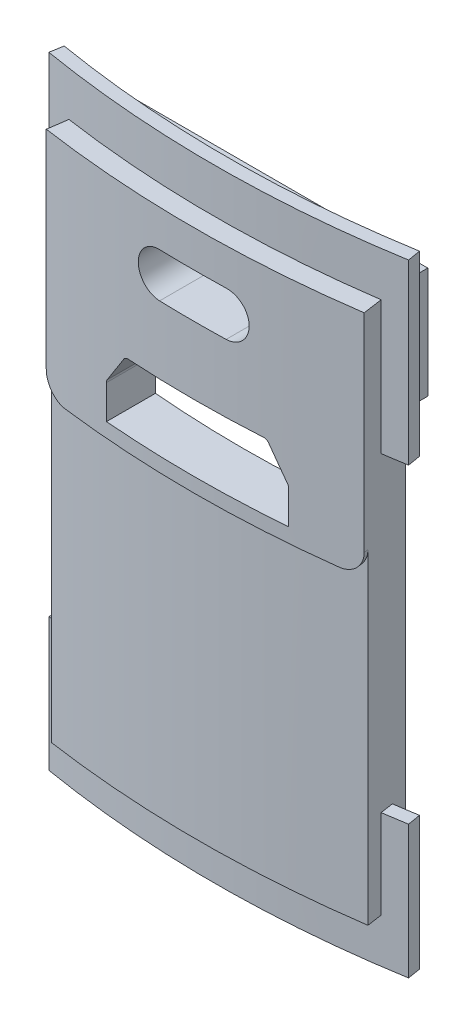
from build123d import *
from build123d.topology import SkipClean

# Parameters (mm, degrees)
EXTRUDE_1_DEPTH          = 24
CUT_EXTRUDE_2_DEPTH      = 5
CUT_EXTRUDE_2_DEPTH_BACK = 5
EXTRUDE_2_DEPTH          = 24
EXTRUDE_START            = 2
EXTRUDE_3_DEPTH          = 2
EXTRUDE_4_DEPTH          = 2
CUT_EXTRUDE_3_DEPTH      = 13.65
FILLET_1_R               = 1
CUT_EXTRUDE_START        = -8
CUT_EXTRUDE_5_DEPTH      = 14
EXTRUDE_START_2          = -5
EXTRUDE_5_DEPTH          = 5
CUT_EXTRUDE_START_2      = -1.49247673
CUT_EXTRUDE_6_DEPTH      = 1.49247673


with BuildPart() as part:
    # Эскиз1 → Бобышка-Вытянуть1 (new body)
    with BuildSketch(Plane(origin=(0, 0, 0), x_dir=(1, 0, 0), z_dir=(0, 1, 0))):
        with BuildLine():
            Line((-6.84384702, 0.49247673), (-7.158835795, -1.684856977))
            ThreePointArc((-7.158835795, -1.684856977), (0, -2.2), (7.158835795, -1.684856977))
            Line((7.158835795, -1.684856977), (6.84384702, 0.49247673))
            ThreePointArc((6.84384702, 0.49247673), (0, 0), (-6.84384702, 0.49247673))
        make_face()
    extrude(amount=EXTRUDE_1_DEPTH)

    # Эскиз2 → Вырез-Вытянуть2 (cut, two sides: drawn at the far end of the back side and taken through both)
    with BuildSketch(Plane.XY.offset(-CUT_EXTRUDE_2_DEPTH_BACK)):
        with BuildLine():
            Line((3.05, 17.3), (-3.05, 17.3))
            ThreePointArc((-3.05, 17.3), (-3.169210201, 17.269768771), (-3.259607324, 17.186381965))
            Line((-3.259607324, 17.186381965), (-4.059452109, 15.958486928))
            ThreePointArc((-4.059452109, 15.958486928), (-4.089648868, 15.893165149), (-4.1, 15.821949749))
            Line((-4.1, 15.821949749), (-4.1, 14.788048333))
            Line((-4.1, 14.788048333), (-4.1, 14.3))
            Line((-4.1, 14.3), (4.1, 14.3))
            Line((4.1, 14.3), (4.1, 14.788048333))
            Line((4.1, 14.788048333), (4.1, 15.821949749))
            ThreePointArc((4.1, 15.821949749), (4.089648868, 15.893165149), (4.059452109, 15.958486928))
            Line((4.059452109, 15.958486928), (3.259607324, 17.186381965))
            ThreePointArc((3.259607324, 17.186381965), (3.169210201, 17.269768771), (3.05, 17.3))
        make_face()
        with BuildLine():
            Line((-0.063165968, 22.35), (1.436834032, 22.35))
            ThreePointArc((1.436834032, 22.35), (2.436834032, 21.35), (1.436834032, 20.35))
            Line((1.436834032, 20.35), (-1.563165968, 20.35))
            ThreePointArc((-1.563165968, 20.35), (-2.563165968, 21.35), (-1.563165968, 22.35))
            Line((-1.563165968, 22.35), (-0.063165968, 22.35))
        make_face()
    extrude(amount=CUT_EXTRUDE_2_DEPTH + CUT_EXTRUDE_2_DEPTH_BACK, mode=Mode.SUBTRACT)

    # Эскиз3 → Бобышка-Вытянуть2 (add)
    with BuildSketch(Plane(origin=(0, 24, 0), x_dir=(1, 0, 0), z_dir=(0, 1, 0))):
        with BuildLine():
            Line((-8.001110971, -0.035470346), (-8.100093787, -0.627249361))
            ThreePointArc((-8.100093787, -0.627249361), (-7.565495415, -0.713640135), (-7.029976751, -0.794129552))
            Line((-7.029976751, -0.794129552), (-6.944070721, -0.200311268))
            ThreePointArc((-6.944070721, -0.200311268), (-7.473045369, -0.120805428), (-8.001110971, -0.035470346))
        make_face()
        with BuildLine():
            Line((8.001110971, -0.035470346), (8.100093787, -0.627249361))
            ThreePointArc((8.100093787, -0.627249361), (7.565495415, -0.713640135), (7.029976751, -0.794129552))
            Line((7.029976751, -0.794129552), (6.944070721, -0.200311268))
            ThreePointArc((6.944070721, -0.200311268), (7.473045369, -0.120805428), (8.001110971, -0.035470346))
        make_face()
    extrude(amount=-EXTRUDE_2_DEPTH)

    # Эскиз4 → Бобышка-Вытянуть3 (add)
    with SkipClean():  # the faces are left unmerged after this step: merging them gives an invalid solid
        with BuildSketch(Plane(origin=(0, 24, 0), x_dir=(1, 0, 0), z_dir=(0, 1, 0)).offset(EXTRUDE_START)):
            with BuildLine():
                Line((-8.001110971, -0.035470346), (-8.100093787, -0.627249361))
                ThreePointArc((-8.100093787, -0.627249361), (0, -1.3), (8.100093787, -0.627249361))
                Line((8.100093787, -0.627249361), (8.001110971, -0.035470346))
                ThreePointArc((8.001110971, -0.035470346), (0, -0.7), (-8.001110971, -0.035470346))
            make_face()
        extrude(amount=-EXTRUDE_3_DEPTH)

    # Эскиз5 → Бобышка-Вытянуть4 (add)
    with SkipClean():  # the faces are left unmerged after this step: merging them gives an invalid solid
        with BuildSketch(Plane.XZ):
            with BuildLine():
                Line((8.001110971, 0.035470346), (8.100093787, 0.627249361))
                ThreePointArc((8.100093787, 0.627249361), (0, 1.3), (-8.100093787, 0.627249361))
                Line((-8.100093787, 0.627249361), (-8.001110971, 0.035470346))
                ThreePointArc((-8.001110971, 0.035470346), (0, 0.7), (8.001110971, 0.035470346))
            make_face()
        extrude(amount=EXTRUDE_4_DEPTH)

    # Эскиз6 → Вырез-Вытянуть3 (cut)
    with SkipClean():  # the faces are left unmerged after this step: merging them gives an invalid solid
        with BuildSketch(Plane.XZ):
            with BuildLine():
                Line((-7.158835795, 1.684856977), (-7.130200452, 1.486917549))
                ThreePointArc((-7.130200452, 1.486917549), (0, 2), (7.130200452, 1.486917549))
                Line((7.130200452, 1.486917549), (7.158835795, 1.684856977))
                ThreePointArc((7.158835795, 1.684856977), (0, 2.2), (-7.158835795, 1.684856977))
            make_face()
        extrude(amount=-CUT_EXTRUDE_3_DEPTH, mode=Mode.SUBTRACT)

    # Скругление1
    fillet_1_edges = [part.edges().sort_by_distance(p)[0] for p in [
        (7.144518124, 13.65, 1.585887263),
        (-7.144518124, 13.65, 1.585887263),
    ]]
    fillet(fillet_1_edges, radius=FILLET_1_R)

    # Эскиз8 → Вырез-Вытянуть5 (cut)
    with SkipClean():  # the faces are left unmerged after this step: merging them gives an invalid solid
        with BuildSketch(Plane(origin=(0, 26, 0), x_dir=(1, 0, 0), z_dir=(0, 1, 0)).offset(CUT_EXTRUDE_START)):
            with BuildLine():
                Line((8.100093787, -0.627249361), (8.001110971, -0.035470346))
                ThreePointArc((8.001110971, -0.035470346), (7.473045369, -0.120805428), (6.944070721, -0.200311268))
                Line((6.944070721, -0.200311268), (7.029976751, -0.794129552))
                ThreePointArc((7.029976751, -0.794129552), (7.565495415, -0.713640135), (8.100093787, -0.627249361))
            make_face()
            with BuildLine():
                Line((-8.001110971, -0.035470346), (-8.100093787, -0.627249361))
                ThreePointArc((-8.100093787, -0.627249361), (-7.565495415, -0.713640135), (-7.029976751, -0.794129552))
                Line((-7.029976751, -0.794129552), (-6.944070721, -0.200311268))
                ThreePointArc((-6.944070721, -0.200311268), (-7.473045369, -0.120805428), (-8.001110971, -0.035470346))
            make_face()
        extrude(amount=-CUT_EXTRUDE_5_DEPTH, mode=Mode.SUBTRACT)

    # Эскиз9 → Бобышка-Вытянуть5 (add)
    with SkipClean():  # the faces are left unmerged after this step: merging them gives an invalid solid
        with BuildSketch(Plane(origin=(0, 24, 0), x_dir=(1, 0, 0), z_dir=(0, 1, 0)).offset(EXTRUDE_START_2)):
            with BuildLine():
                Line((-6.84384702, 0.49247673), (-6.84384702, 1.49247673))
                Line((-6.84384702, 1.49247673), (6.84384702, 1.49247673))
                Line((6.84384702, 1.49247673), (6.84384702, 0.49247673))
                ThreePointArc((6.84384702, 0.49247673), (0, 0), (-6.84384702, 0.49247673))
            make_face()
        extrude(amount=EXTRUDE_5_DEPTH)

    # Эскиз10 → Вырез-Вытянуть6 (cut)
    with SkipClean():  # the faces are left unmerged after this step: merging them gives an invalid solid
        with BuildSketch(Plane.XY.offset(CUT_EXTRUDE_START_2)):
            with BuildLine():
                Line((1.436834032, 20.35), (-1.563165968, 20.35))
                ThreePointArc((-1.563165968, 20.35), (-2.563165968, 21.35), (-1.563165968, 22.35))
                Line((-1.563165968, 22.35), (1.436834032, 22.35))
                ThreePointArc((1.436834032, 22.35), (2.436834032, 21.35), (1.436834032, 20.35))
            make_face()
        extrude(amount=CUT_EXTRUDE_6_DEPTH, mode=Mode.SUBTRACT)


solid = part.part
